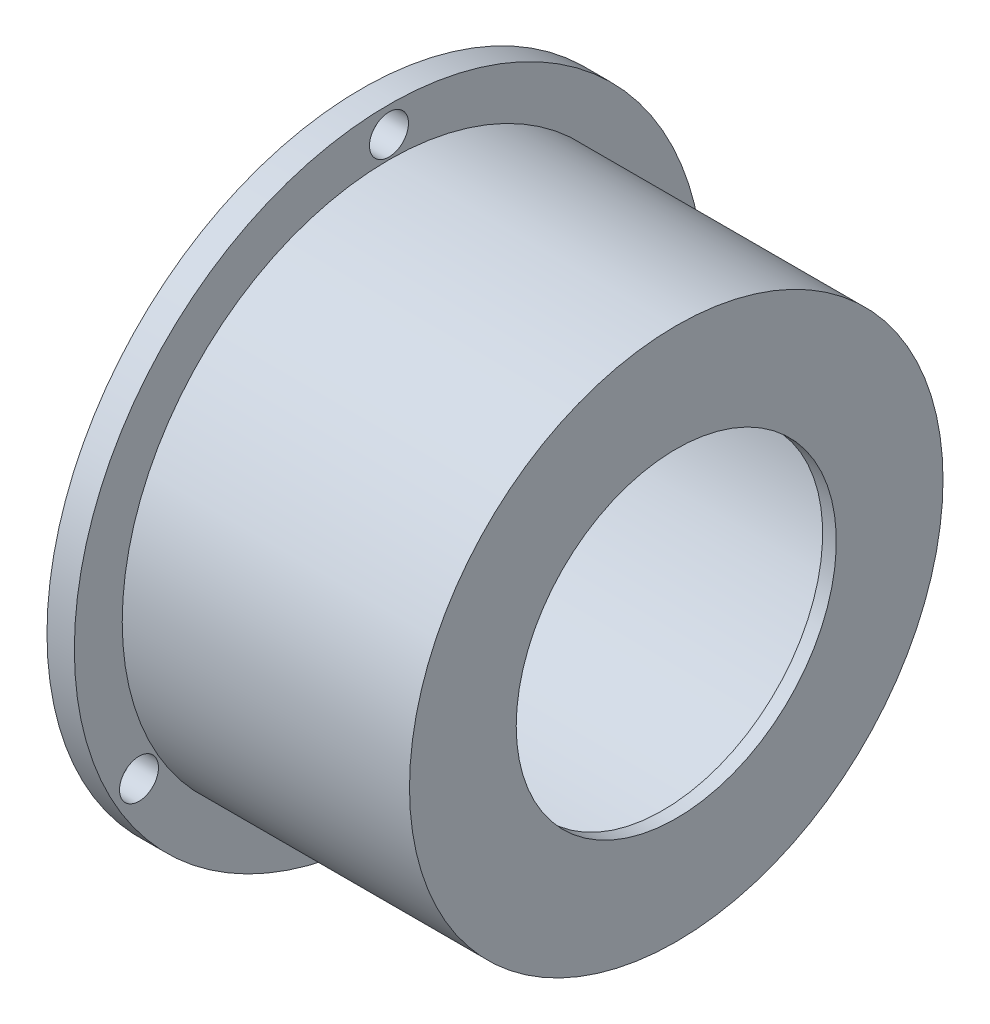
from build123d import *

# Parameters (mm, degrees)
AXIAL_HOLES_DEPTH      = 193.994533601
AXIAL_HOLES_DEPTH_BACK = 193.994533601
SKETCH2_R              = 1.65
CUT_EXTRUDE2_START     = 135.7
SKETCH3_R              = 2.85
CUT_EXTRUDE2_DEPTH     = 4


with BuildPart() as part:
    # Axial profile (mm) → Full revolution (revolve)
    with BuildSketch(Plane.XY, mode=Mode.PRIVATE) as full_revolution_sk:
        Polygon((135.7, 36.4), (179.7, 36.4), (179.7, 23.4), (181.7, 23.4), (181.7, 39), (139.7, 39), (139.7, 46), (135.7, 46), align=None)
    revolve(full_revolution_sk.sketch.rotate(Axis((-110, 0, 0), (1, 0, 0)), 90), axis=Axis((-110, 0, 0), (1, 0, 0)))

    # Sketch2 → Axial holes (cut, two sides: drawn at the far end of the back side and taken through both)
    with BuildSketch(Plane(origin=(0, 0, 0), x_dir=(0, 0, -1), z_dir=(1, 0, 0)).offset(-AXIAL_HOLES_DEPTH_BACK)):
        with Locations(Location((0, 42.2, 0), (0, 0, 180))):
            Circle(SKETCH2_R)
        with Locations(Location((-36.54627204, -21.1, 0), (0, 0, 180))):
            Circle(SKETCH2_R)
        with Locations(Location((36.54627204, -21.1, 0), (0, 0, 180))):
            Circle(SKETCH2_R)
    extrude(amount=AXIAL_HOLES_DEPTH + AXIAL_HOLES_DEPTH_BACK, mode=Mode.SUBTRACT)

    # Sketch3 → Cut-Extrude2 (cut)
    with BuildSketch(Plane(origin=(0, 0, 0), x_dir=(0, 0, -1), z_dir=(1, 0, 0)).offset(CUT_EXTRUDE2_START)):
        with Locations((0, 42.2)):
            Circle(SKETCH3_R)
        with Locations((-36.54627204, -21.1)):
            Circle(SKETCH3_R)
        with Locations((36.54627204, -21.1)):
            Circle(SKETCH3_R)
    extrude(amount=CUT_EXTRUDE2_DEPTH, mode=Mode.SUBTRACT)


solid = part.part
